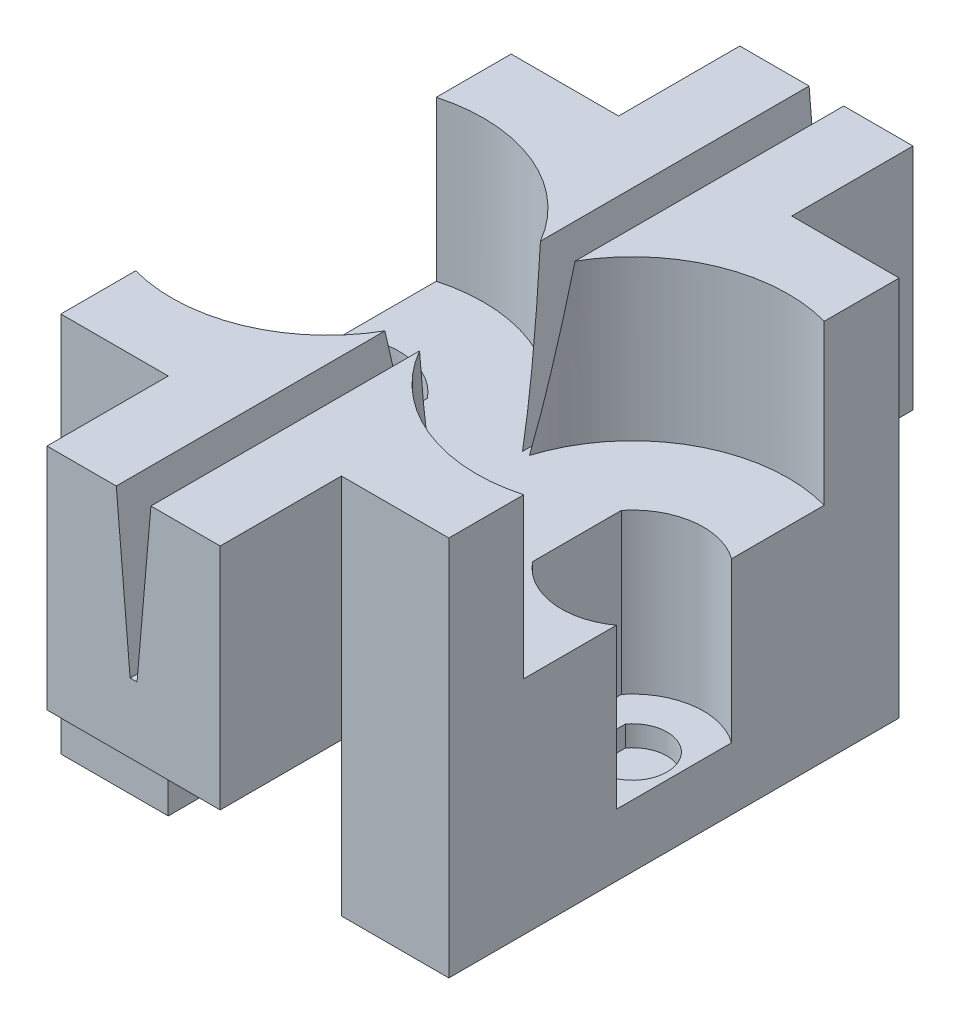
from build123d import *

# Parameters (mm, degrees)
SKETCH1_W           = 56
SKETCH1_H           = 100
BOSS_EXTRUDE1_DEPTH = 55
CUT_EXTRUDE2_DEPTH  = 118.511701545
SKETCH7_R           = 22.5
SKETCH7_R_2         = 10
CUT_EXTRUDE4_DEPTH  = 23
CUT_EXTRUDE5_DEPTH  = 46
CUT_EXTRUDE6_DEPTH  = 3
CUT_EXTRUDE7_DEPTH  = 23
SKETCH12_W          = 15.5
SKETCH12_H          = 17.5
CUT_EXTRUDE8_DEPTH  = 80.429213769
SKETCH13_W          = 25
SKETCH13_H          = 22
CUT_EXTRUDE9_DEPTH  = 118.511701545


with BuildPart() as part:
    # Sketch1 → Boss-Extrude1 (new body)
    with BuildSketch(Plane(origin=(0, 0, 0), x_dir=(1, 0, 0), z_dir=(0, 1, 0))):
        Rectangle(SKETCH1_W, SKETCH1_H)
    extrude(amount=BOSS_EXTRUDE1_DEPTH)

    # Sketch3 → Cut-Extrude2 (cut, through all)
    with BuildSketch(Plane.XY.offset(50)):
        Polygon((-0.5, 32), (-2.5, 55), (2.5, 55), (0.5, 32), align=None)
    extrude(amount=-CUT_EXTRUDE2_DEPTH, mode=Mode.SUBTRACT)

    # Sketch7 → Cut-Extrude4 (cut)
    with BuildSketch(Plane(origin=(0, 55, 0), x_dir=(1, 0, 0), z_dir=(0, 1, 0))):
        with Locations((22, 0)):
            Circle(SKETCH7_R)
        with Locations((22, 0)):
            Circle(SKETCH7_R_2, mode=Mode.SUBTRACT)
    cut_extrude4 = extrude(amount=-CUT_EXTRUDE4_DEPTH, mode=Mode.SUBTRACT)

    # Sketch9 → Cut-Extrude5 (cut)
    with BuildSketch(Plane(origin=(0, 55, 0), x_dir=(1, 0, 0), z_dir=(0, 1, 0))):
        with BuildLine():
            Line((14, 6.408002809), (14, -6.408002809))
            ThreePointArc((14, -6.408002809), (32.25, 0), (14, 6.408002809))
        make_face()
    cut_extrude5 = extrude(amount=-CUT_EXTRUDE5_DEPTH, mode=Mode.SUBTRACT)

    # Sketch10 → Cut-Extrude6 (cut)
    with BuildSketch(Plane(origin=(0, 9, 0), x_dir=(1, 0, 0), z_dir=(0, 1, 0))):
        with BuildLine():
            Line((18, 3), (18, -3))
            ThreePointArc((18, -3), (27, 0), (18, 3))
        make_face()
    cut_extrude6 = extrude(amount=-CUT_EXTRUDE6_DEPTH, mode=Mode.SUBTRACT)

    # Sketch11 → Cut-Extrude7 (cut)
    with BuildSketch(Plane(origin=(0, 55, 0), x_dir=(1, 0, 0), z_dir=(0, 1, 0))):
        with BuildLine():
            Line((14, 6.408002809), (14, -6.408002809))
            ThreePointArc((14, -6.408002809), (11.677076266, 0), (14, 6.408002809))
        make_face()
    cut_extrude7 = extrude(amount=-CUT_EXTRUDE7_DEPTH, mode=Mode.SUBTRACT)

    # Mirror1: Cut-Extrude4, Cut-Extrude5, Cut-Extrude6, Cut-Extrude7 across plane
    add(cut_extrude4.mirror(Plane(origin=(0, 0, 0), x_dir=(0, 0, 1), z_dir=(1, 0, 0))), mode=Mode.SUBTRACT)
    add(cut_extrude5.mirror(Plane(origin=(0, 0, 0), x_dir=(0, 0, 1), z_dir=(1, 0, 0))), mode=Mode.SUBTRACT)
    add(cut_extrude6.mirror(Plane(origin=(0, 0, 0), x_dir=(0, 0, 1), z_dir=(1, 0, 0))), mode=Mode.SUBTRACT)
    add(cut_extrude7.mirror(Plane(origin=(0, 0, 0), x_dir=(0, 0, 1), z_dir=(1, 0, 0))), mode=Mode.SUBTRACT)

    # Sketch12 → Cut-Extrude8 (cut, through all)
    with BuildSketch(Plane(origin=(0, 55, 0), x_dir=(1, 0, 0), z_dir=(0, 1, 0))):
        with Locations((-20.25, 41.25)):
            Rectangle(SKETCH12_W, SKETCH12_H)
        with Locations((20.25, 41.25)):
            Rectangle(SKETCH12_W, SKETCH12_H)
        with Locations((-20.25, -41.25)):
            Rectangle(SKETCH12_W, SKETCH12_H)
        with Locations((20.25, -41.25)):
            Rectangle(SKETCH12_W, SKETCH12_H)
    extrude(amount=-CUT_EXTRUDE8_DEPTH, mode=Mode.SUBTRACT)

    # Sketch13 → Cut-Extrude9 (cut, through all)
    with BuildSketch(Plane.XY.offset(50)):
        with Locations((0, 11)):
            Rectangle(SKETCH13_W, SKETCH13_H)
    extrude(amount=-CUT_EXTRUDE9_DEPTH, mode=Mode.SUBTRACT)


solid = part.part
